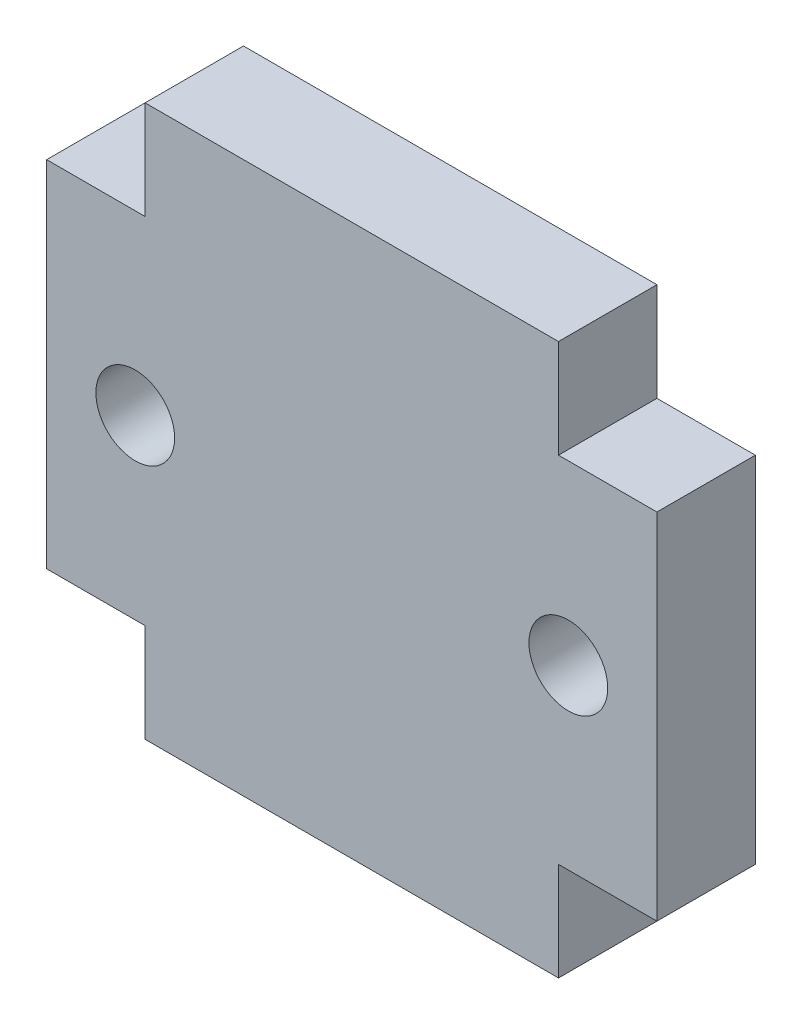
from build123d import *

# Parameters (mm, degrees)
SKETCH1_R           = 2
BOSS_EXTRUDE1_DEPTH = 5


with BuildPart() as part:
    # Sketch1 → Boss-Extrude1 (new body)
    with BuildSketch(Plane.XY):
        Polygon((-15.5, -9), (-15.5, 9), (-10.5, 9), (-10.5, 14), (10.5, 14), (10.5, 9), (15.5, 9), (15.5, -9), (10.5, -9), (10.5, -14), (-10.5, -14), (-10.5, -9), align=None)
        with Locations((-11, 0)):
            Circle(SKETCH1_R, mode=Mode.SUBTRACT)
        with Locations((11, 0)):
            Circle(SKETCH1_R, mode=Mode.SUBTRACT)
    extrude(amount=BOSS_EXTRUDE1_DEPTH)


solid = part.part
